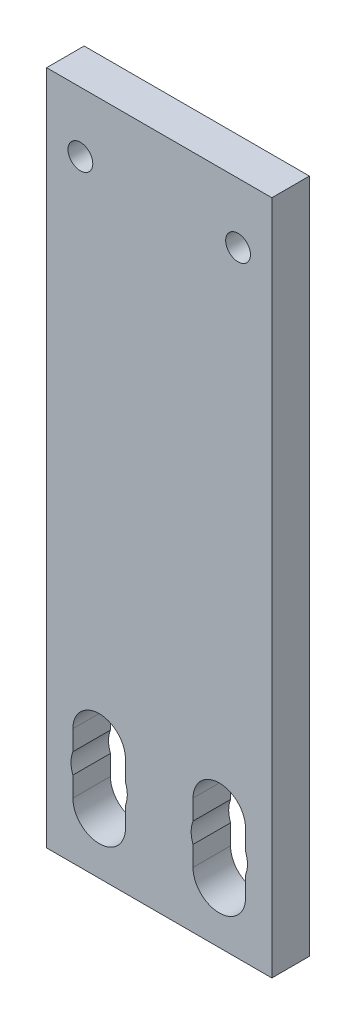
from build123d import *

# Parameters (mm, degrees)
SKIZZE2_W                       = 30
SKIZZE2_H                       = 90
AUFSATZ_LINEAR_AUSTRAGEN2_DEPTH = 2.5
SCHNITT_LINEAR_AUSTRAGEN1_DEPTH = 5
M4_GEWINDEBOHRUNG1_D            = 3.3
M4_GEWINDEBOHRUNG1_DEPTH        = 11.5
M4_GEWINDEBOHRUNG1_TIP          = 0.991420021


with BuildPart() as part:
    # Skizze2 → Aufsatz-Linear austragen2 (new, symmetric)
    with BuildSketch(Plane.XY):
        with Locations((0, 45)):
            Rectangle(SKIZZE2_W, SKIZZE2_H)
    extrude(amount=AUFSATZ_LINEAR_AUSTRAGEN2_DEPTH, both=True)

    # Skizze1 → Schnitt-Linear austragen1 (cut, symmetric)
    with BuildSketch(Plane.XY):
        with BuildLine():
            Line((-11.5, 12.846291202), (-11.5, 15.5))
            ThreePointArc((-11.5, 15.5), (-8, 19), (-4.5, 15.5))
            Line((-4.5, 15.5), (-4.5, 12.846291202))
            ThreePointArc((-4.5, 12.846291202), (-4.25, 11.5), (-4.5, 10.153708798))
            Line((-4.5, 10.153708798), (-4.5, 7.5))
            ThreePointArc((-4.5, 7.5), (-8, 4), (-11.5, 7.5))
            Line((-11.5, 7.5), (-11.5, 10.153708798))
            ThreePointArc((-11.5, 10.153708798), (-11.75, 11.5), (-11.5, 12.846291202))
        make_face()
        with BuildLine():
            Line((4.5, 12.846291202), (4.5, 15.5))
            ThreePointArc((4.5, 15.5), (8, 19), (11.5, 15.5))
            Line((11.5, 15.5), (11.5, 12.846291202))
            ThreePointArc((11.5, 12.846291202), (11.75, 11.5), (11.5, 10.153708798))
            Line((11.5, 10.153708798), (11.5, 7.5))
            ThreePointArc((11.5, 7.5), (8, 4), (4.5, 7.5))
            Line((4.5, 7.5), (4.5, 10.153708798))
            ThreePointArc((4.5, 10.153708798), (4.25, 11.5), (4.5, 12.846291202))
        make_face()
    extrude(amount=SCHNITT_LINEAR_AUSTRAGEN1_DEPTH, both=True, mode=Mode.SUBTRACT)

    # M4 Gewindebohrung1
    with Locations(Plane.XY.offset(2.5)):
        with Locations((-10.5, 82), (10.5, 82)):
            Hole(M4_GEWINDEBOHRUNG1_D / 2, depth=M4_GEWINDEBOHRUNG1_DEPTH)
            with Locations((0, 0, -(M4_GEWINDEBOHRUNG1_DEPTH + M4_GEWINDEBOHRUNG1_TIP / 2))):  # 118° drill point
                Cone(0, M4_GEWINDEBOHRUNG1_D / 2, M4_GEWINDEBOHRUNG1_TIP, mode=Mode.SUBTRACT)


solid = part.part
